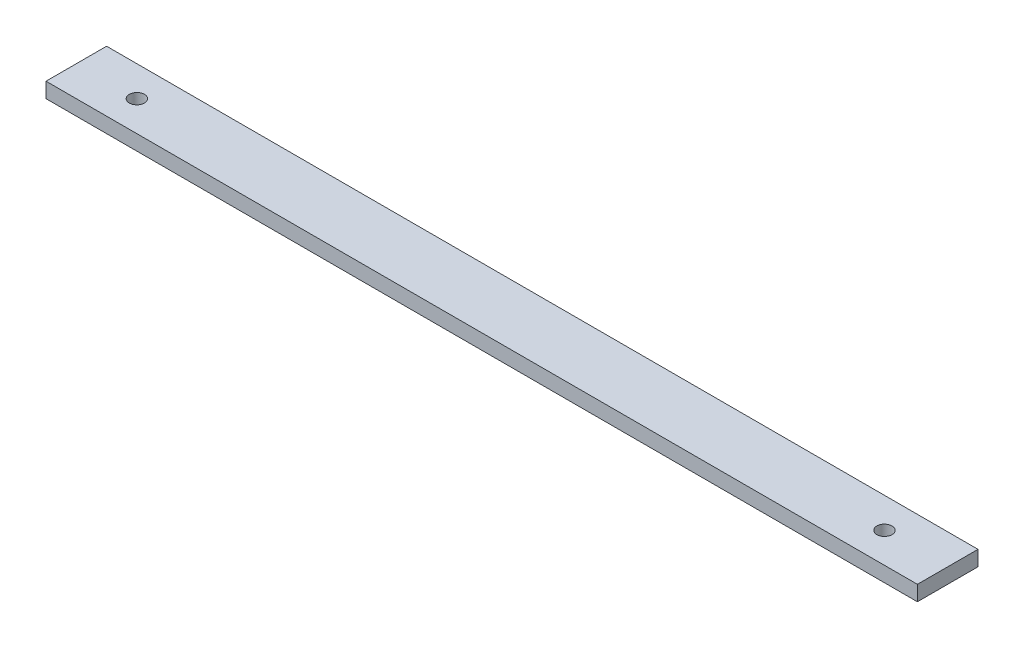
from build123d import *

# Parameters (mm, degrees)
SKETCH1_W           = 365.252
SKETCH1_H           = 25.4
BOSS_EXTRUDE1_DEPTH = 6.35
CUT_EXTRUDE1_REACH  = 368.189
SKETCH2_R           = 3.175


with BuildPart() as part:
    # Sketch1 → Boss-Extrude1 (new body)
    with BuildSketch(Plane(origin=(0, 0, 0), x_dir=(1, 0, 0), z_dir=(0, 1, 0))):
        with Locations((182.626, -12.7)):
            Rectangle(SKETCH1_W, SKETCH1_H)
    extrude(amount=BOSS_EXTRUDE1_DEPTH)

    # Sketch2 → Cut-Extrude1 (cut, up to next)
    with BuildSketch(Plane.XZ, mode=Mode.PRIVATE) as cut_extrude1_sk1:
        with Locations(Location((25.4, 12.7, 0), (0, 0, 270))):
            Circle(SKETCH2_R)
    cut_extrude1_tool1 = extrude(cut_extrude1_sk1.sketch, amount=-CUT_EXTRUDE1_REACH, mode=Mode.PRIVATE) & part.part
    # Sketch2 → Cut-Extrude1 (cut, up to next)
    with BuildSketch(Plane.XZ, mode=Mode.PRIVATE) as cut_extrude1_sk2:
        with Locations(Location((338.738972, 12.7, 0), (0, 0, 270))):
            Circle(SKETCH2_R)
    cut_extrude1_tool2 = extrude(cut_extrude1_sk2.sketch, amount=-CUT_EXTRUDE1_REACH, mode=Mode.PRIVATE) & part.part
    add(cut_extrude1_tool1.solids().sort_by_distance((25.4, 0, 12.7))[0], mode=Mode.SUBTRACT)
    add(cut_extrude1_tool2.solids().sort_by_distance((338.738972, 0, 12.7))[0], mode=Mode.SUBTRACT)


solid = part.part
